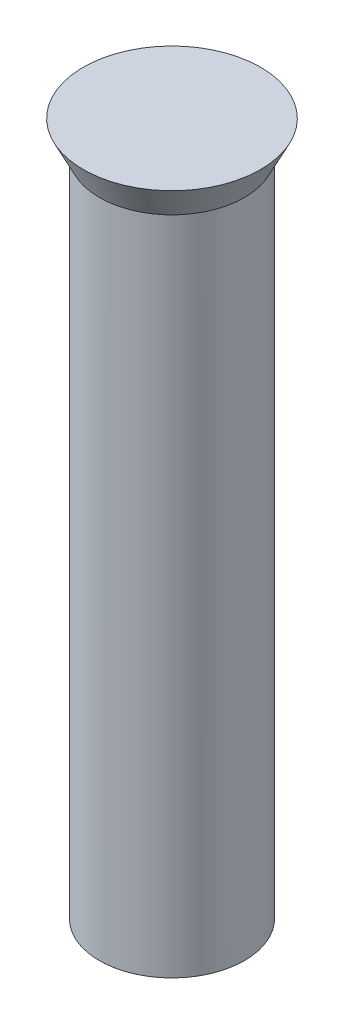
from build123d import *

# Parameters (mm, degrees)
SKETCH1_R           = 9
BOSS_EXTRUDE1_DEPTH = 80
BOSS_EXTRUDE2_START = 2
SKETCH2_R           = 9
BOSS_EXTRUDE2_DEPTH = 2


with BuildPart() as part:
    # Sketch1 → Boss-Extrude1 (new body)
    with BuildSketch(Plane(origin=(0, 0, 0), x_dir=(1, 0, 0), z_dir=(0, 1, 0))):
        with Locations(Location((0, 0, 0), (0, 0, 270))):
            Circle(SKETCH1_R)
    extrude(amount=BOSS_EXTRUDE1_DEPTH)

    # Sketch2 → Boss-Extrude2 (add)
    with BuildSketch(Plane.XZ.offset(BOSS_EXTRUDE2_START)):
        with Locations(Location((0, 0, 0), (0, 0, 270))):
            Circle(SKETCH2_R)
    extrude(amount=-BOSS_EXTRUDE2_DEPTH)

    # Sketch4 → Revolve1 (revolve)
    with BuildSketch(Plane(origin=(0, 0, 0), x_dir=(0, 0, -1), z_dir=(1, 0, 0))):
        Polygon((9, 80), (0, 80), (0, 84.007892879), (11, 84.007892879), align=None)
    revolve(axis=Axis((0, 75.015231433, 0), (0, 1, 0)))


solid = part.part
